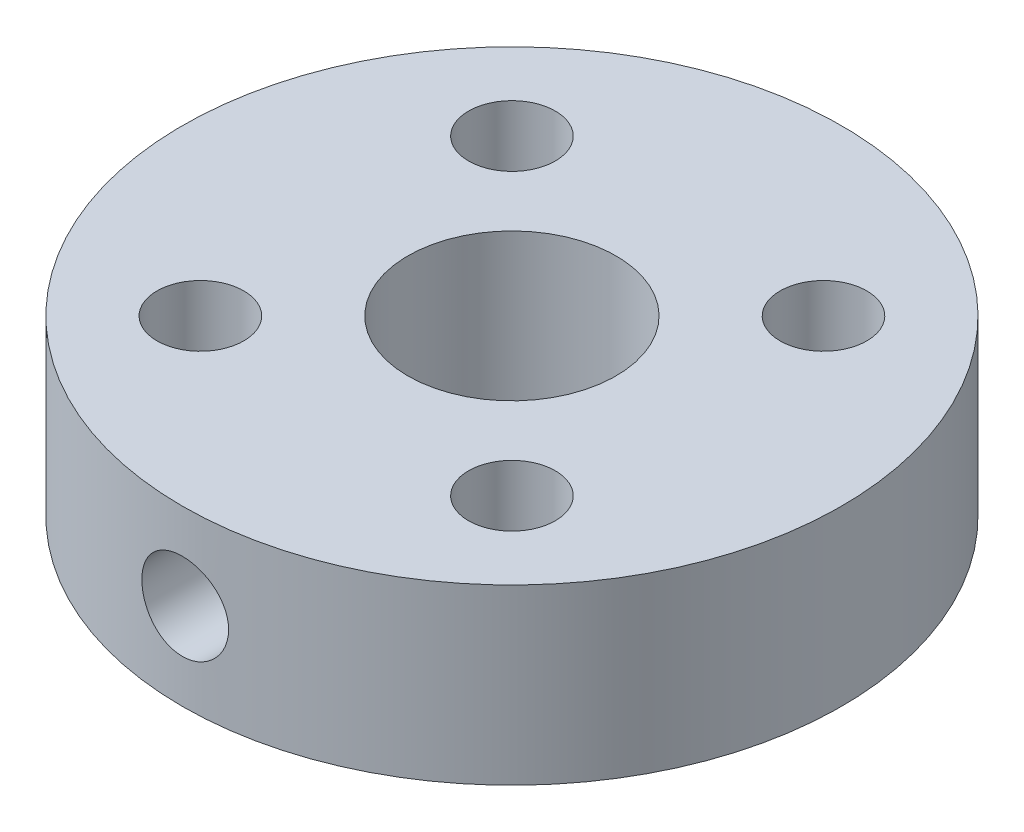
from build123d import *

# Parameters (mm, degrees)
SKETCH1_R                 = 9.5
BOSS_EXTRUDE1_DEPTH       = 5
F_6_0MM_DOWEL_HOLE1_D     = 6
M3X0_5_TAPPED_HOLE1_D     = 2.5
M3X0_5_TAPPED_HOLE2_D     = 2.5
M3X0_5_TAPPED_HOLE2_DEPTH = 10
M3X0_5_TAPPED_HOLE2_TIP   = 0.751075774


with BuildPart() as part:
    # Sketch1 → Boss-Extrude1 (new body)
    with BuildSketch(Plane(origin=(0, 0, 0), x_dir=(1, 0, 0), z_dir=(0, 1, 0))):
        with Locations(Location((0, 0, 0), (0, 0, 270))):
            Circle(SKETCH1_R)
    extrude(amount=BOSS_EXTRUDE1_DEPTH)

    # Ø6.0mm Dowel Hole1 (through all)
    with Locations(Plane(origin=(0, 5, 0), x_dir=(1, 0, 0), z_dir=(0, 1, 0))):
        with Locations((0, 0)):
            Hole(F_6_0MM_DOWEL_HOLE1_D / 2)

    # M3x0.5 Tapped Hole1 (through all)
    with Locations(Plane(origin=(0, 5, 0), x_dir=(1, 0, 0), z_dir=(0, 1, 0))):
        with Locations((4.490128061, 4.490128061), (-4.490128061, 4.490128061), (-4.490128061, -4.490128061), (4.490128061, -4.490128061)):
            Hole(M3X0_5_TAPPED_HOLE1_D / 2)

    # M3x0.5 Tapped Hole2
    with Locations(Plane(origin=(0, 2.5, 9.5), x_dir=(1, 0, 0), z_dir=(0, 0, 1))):
        with Locations((0, 0)):
            Hole(M3X0_5_TAPPED_HOLE2_D / 2, depth=M3X0_5_TAPPED_HOLE2_DEPTH)
            with Locations((0, 0, -(M3X0_5_TAPPED_HOLE2_DEPTH + M3X0_5_TAPPED_HOLE2_TIP / 2))):  # 118° drill point
                Cone(0, M3X0_5_TAPPED_HOLE2_D / 2, M3X0_5_TAPPED_HOLE2_TIP, mode=Mode.SUBTRACT)


solid = part.part
